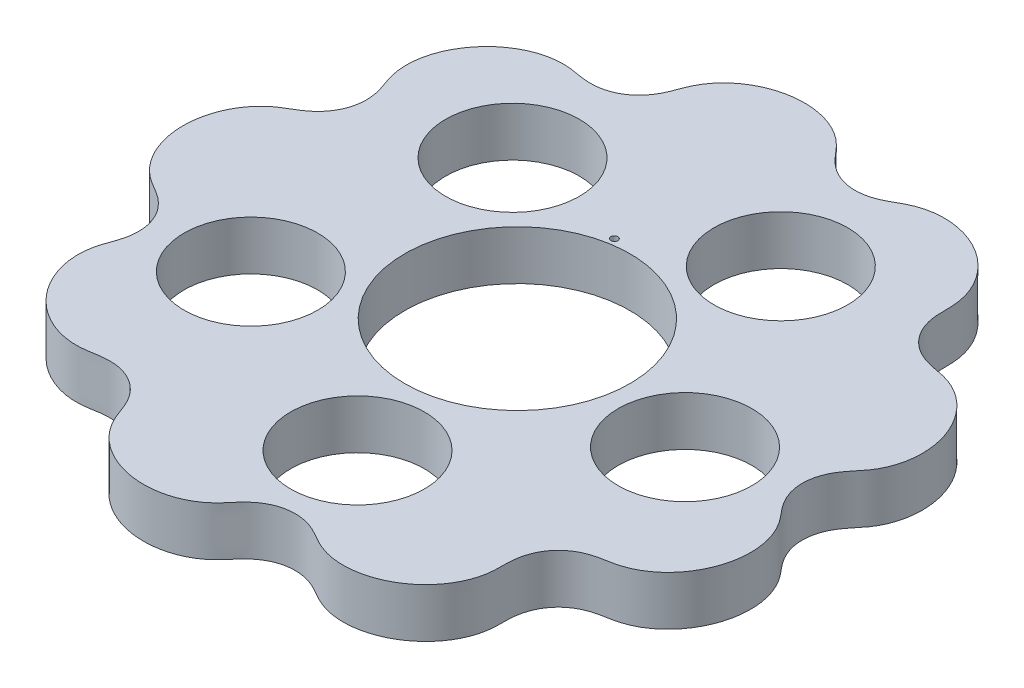
from build123d import *

# Parameters (mm, degrees)
BOSS_EXTRUDE3_DEPTH = 7
SKETCH2_R           = 16
CUT_EXTRUDE1_DEPTH  = 68.161043744
SKETCH3_R           = 0.5
CUT_EXTRUDE2_DEPTH  = 1
SKETCH4_R           = 9.5
CUT_EXTRUDE4_DEPTH  = 68.161043744
CIRPATTERN2_COUNT   = 5


with BuildPart() as part:
    # Sketch1 → Boss-Extrude3 (new body)
    with BuildSketch(Plane(origin=(0, 0, 0), x_dir=(1, 0, 0), z_dir=(0, 1, 0))):
        with BuildLine():
            add(Edge.make_bspline(
                [(40.5, 0), (40.5, -0.028546262), (40.500444384, -0.085847505), (40.503110675, -0.226757994), (40.512439134, -0.442367355), (40.531079589, -0.666953273), (40.562964523, -0.93744797), (40.605352949, -1.20098898), (40.671319498, -1.530508494), (40.770992467, -1.920340014), (40.916415736, -2.367488249), (41.120787297, -2.86406858), (41.360828638, -3.344593408), (41.654124201, -3.842056085), (42.004011353, -4.351634881), (42.409931661, -4.87004421), (42.859744386, -5.404533646), (43.412858525, -6.080456207), (44.011394999, -6.943224647), (44.526656093, -7.941817117), (44.929873097, -9.064739057), (45.239557641, -10.363340474), (45.403552015, -11.834318039), (45.343955448, -13.562903017), (44.952767157, -15.484258179), (44.263691832, -17.30324519), (43.301446593, -18.976060486), (42.091119135, -20.460306087), (40.745114847, -21.632645784), (39.4837748, -22.404905161), (38.409421356, -22.87085064), (37.58482604, -23.133693034), (36.911896387, -23.296665171), (36.231624071, -23.422347011), (35.550357106, -23.543060285), (34.525833701, -23.764578493), (33.191664696, -24.223802594), (31.668403783, -25.17653147), (30.277453911, -26.838539011), (29.606690168, -28.516326966), (29.392777642, -29.929876757), (29.357806824, -30.990097872), (29.358413065, -31.688831297), (29.349816232, -32.38747332), (29.299961965, -33.084991258), (29.174540456, -33.950025236), (28.884387048, -35.107402938), (28.311499455, -36.509844746), (27.339845304, -38.066173972), (26.017933712, -39.535863134), (24.483232188, -40.756368749), (22.786217155, -41.706943572), (20.973888334, -42.369957392), (19.092781226, -42.729068837), (17.308191097, -42.762066376), (15.845599211, -42.543012056), (14.723107044, -42.209492119), (13.922481374, -41.880898383), (13.302227917, -41.573264045), (12.700331173, -41.232317813), (12.100892811, -40.886879519), (11.173757722, -40.397959474), (9.856673355, -39.891987769), (8.077462722, -39.642383823), (5.943546794, -40.021078588), (4.35107352, -40.874919681), (3.278410562, -41.82014524), (2.570026037, -42.609815625), (2.121324054, -43.14548158), (1.665672599, -43.675196771), (1.17915445, -44.177550209), (0.527074936, -44.759678615), (-0.439116024, -45.459900339), (-1.779443431, -46.16613343), (-3.524197134, -46.733933196), (-5.481604637, -47.01020213), (-7.441825317, -46.958776742), (-9.352850307, -46.596232476), (-11.167346953, -45.939296019), (-12.839175378, -45.005380711), (-14.227481209, -43.883694812), (-15.207137934, -42.775886443), (-15.8527027, -41.798978164), (-16.254862767, -41.032703987), (-16.532309197, -40.398405281), (-16.774256512, -39.750374585), (-17.011382172, -39.100464804), (-17.407232747, -38.129986286), (-18.090734887, -36.895738292), (-19.292992813, -35.560693356), (-21.170888335, -34.478791677), (-22.939600319, -34.108936434), (-24.368953497, -34.143319399), (-25.419255652, -34.292817002), (-26.107333056, -34.414733809), (-26.796899433, -34.527678603), (-27.492523445, -34.599847189), (-28.366265702, -34.626726892), (-29.556564689, -34.542186472), (-31.037364726, -34.221759337), (-32.739020732, -33.535305745), (-34.416198682, -32.488799683), (-35.884858276, -31.18944768), (-37.115823469, -29.683399253), (-38.083603628, -28.013906623), (-38.764068432, -26.223973991), (-39.106677701, -24.472428153), (-39.145177857, -22.994155066), (-39.011885669, -21.830876801), (-38.827502006, -20.985391696), (-38.632390711, -20.321161986), (-38.401231573, -19.669237126), (-38.16512026, -19.018990926), (-37.844472406, -18.021185774), (-37.574515437, -16.63645071), (-37.637035998, -14.840974018), (-38.379780688, -12.804965911), (-39.496728402, -11.38451469), (-40.613694939, -10.491881423), (-41.514358285, -9.93118044), (-42.119843128, -9.582259903), (-42.720728116, -9.225557564), (-43.300060014, -8.833742323), (-43.986749018, -8.292751926), (-44.844349958, -7.462927163), (-45.772882603, -6.265657891), (-46.635339888, -4.645985087), (-47.247585718, -2.766214576), (-47.53755206, -0.826771723), (-47.512538074, 1.118150057), (-47.180899933, 3.019157212), (-46.551717848, 4.82759835), (-45.688513543, 6.389712558), (-44.659677617, 7.682658763), (-43.660583675, 8.585180175), (-42.80632761, 9.177558511), (-42.061022055, 9.615676605), (-41.462290621, 9.962188423), (-40.575230987, 10.520252942), (-39.478283352, 11.407345976), (-38.371827395, 12.822697306), (-37.631719247, 14.859682224), (-37.573981258, 16.66577966), (-37.855665099, 18.067658738), (-38.185125935, 19.076182338), (-38.424672753, 19.732705207), (-38.655741816, 20.392209654), (-38.84775704, 21.064754755), (-39.026145406, 21.920593216), (-39.149828944, 23.107566863), (-39.09166123, 24.621654983), (-38.711352212, 26.416866751), (-37.972140765, 28.250537991), (-36.947690329, 29.922687192), (-35.678415605, 31.396609852), (-34.202539584, 32.639673184), (-32.558208903, 33.620763916), (-30.893027292, 34.262453372), (-29.444043299, 34.557364541), (-28.275455034, 34.628220061), (-27.410787202, 34.59381281), (-26.72299369, 34.51674286), (-25.869954657, 34.37468004), (-24.669041681, 34.158214449), (-23.08279894, 34.077875033), (-21.153335322, 34.487400981), (-19.276935597, 35.57150577), (-18.071444448, 36.917919199), (-17.385945872, 38.172738501), (-16.989933536, 39.157152765), (-16.751426332, 39.814042019), (-16.504532297, 40.467847806), (-16.219376456, 41.106515426), (-15.805967264, 41.876873687), (-15.137812701, 42.865756434), (-14.120067415, 43.988363872), (-12.674813604, 45.119268791), (-10.929865296, 46.048932451), (-9.07024603, 46.671478061), (-7.150520531, 46.984788652), (-5.22094989, 46.988455169), (-3.330749558, 46.683186857), (-1.642708761, 46.104538007), (-0.343153942, 45.399206832), (0.597608896, 44.702454803), (1.237898732, 44.120391681), (1.715264854, 43.619314217), (2.277428439, 42.962224797), (3.05814935, 42.024466828), (4.221431586, 40.943188501), (5.962527814, 40.016387543), (8.096711616, 39.640341864), (9.8857068, 39.896574295), (11.217544346, 40.417019048), (12.153760139, 40.916512679), (12.758740403, 41.266413668), (13.368136186, 41.608608887), (13.997103, 41.914636892), (14.808971415, 42.239129975), (15.956466314, 42.567304505), (17.457750275, 42.77321507), (19.291893972, 42.710676226), (21.226285158, 42.301308336), (23.051077454, 41.582944449), (24.72311385, 40.58906004), (26.203639767, 39.351667841), (27.455428384, 37.902959871), (28.376663871, 36.374770576), (28.918896787, 34.999224905), (29.191799656, 33.860848331), (29.308231189, 33.003441465), (29.35189076, 32.312783633), (29.360213444, 31.448109042), (29.355429648, 30.227962288), (29.55128759, 28.651955964), (30.288977261, 26.822741751), (31.681833263, 25.162592811), (33.216849137, 24.208650605), (34.571622102, 23.751028062), (35.609898879, 23.531775073), (36.298280537, 23.410922873), (36.985100939, 23.281383187), (37.663674553, 23.111581309), (38.494246664, 22.838372965), (39.584321034, 22.352260536), (40.866852273, 21.545065261), (42.231836487, 20.318237829), (43.450673844, 18.761249102), (44.386902236, 17.038007017), (45.028986087, 15.201914615), (45.325834952, 13.537932906), (45.38524027, 12.105954443), (45.301179192, 10.916329332), (45.151752518, 9.973924387), (44.891593523, 8.9443326), (44.543978069, 8.009424638), (44.128014858, 7.175589871), (43.712312671, 6.517140841), (43.409686217, 6.095664039), (43.090923809, 5.686434175), (42.815647705, 5.353194457), (42.538178372, 5.021818387), (42.266840334, 4.685368008), (42.055952198, 4.411281643), (41.826782884, 4.093710697), (41.585989593, 3.728402516), (41.342712158, 3.310613657), (41.108278103, 2.835929575), (40.908702201, 2.34568584), (40.766567017, 1.904604137), (40.669049377, 1.520127878), (40.604388983, 1.195338878), (40.562761071, 0.935408444), (40.531326441, 0.668993371), (40.512839165, 0.447641437), (40.503412283, 0.23442177), (40.500585942, 0.096138553), (40.50005783, 0.039653659), (40.500009824, 0.011516445)],
                knots=[0.074406451, 0.074406451, 0.074406451, 0.074406451, 0.074406451, 0.074767472, 0.075128494, 0.075850538, 0.076572582, 0.077294626, 0.07801667, 0.078738713, 0.080182801, 0.081626889, 0.083070976, 0.084515064, 0.085959151, 0.087839211, 0.089719271, 0.09159933, 0.09347939, 0.097239509, 0.100999628, 0.103646586, 0.106293543, 0.111587458, 0.116881374, 0.122175289, 0.127305755, 0.132436222, 0.137566688, 0.142697155, 0.146420505, 0.148282179, 0.150143854, 0.152005529, 0.153867204, 0.155728878, 0.157590553, 0.163285985, 0.168981417, 0.174757993, 0.180534569, 0.18241471, 0.184294852, 0.186174994, 0.188055135, 0.189935277, 0.191815418, 0.195575702, 0.200869839, 0.206163976, 0.211458113, 0.21675225, 0.221882498, 0.227012746, 0.232142994, 0.237273242, 0.240996426, 0.242858018, 0.24471961, 0.246581203, 0.248442795, 0.250304387, 0.252165979, 0.257861181, 0.263556383, 0.269333184, 0.275109986, 0.276990209, 0.278870433, 0.280750657, 0.28263088, 0.284511104, 0.286391328, 0.290151775, 0.295446135, 0.300740494, 0.306034853, 0.311329212, 0.316459241, 0.32158927, 0.326719299, 0.331849328, 0.335572348, 0.337433857, 0.339295367, 0.341156877, 0.343018386, 0.344879896, 0.346741406, 0.352436377, 0.358131349, 0.363908375, 0.369685402, 0.371565708, 0.373446014, 0.37532632, 0.377206626, 0.379086932, 0.380967237, 0.384727849, 0.39002243, 0.395317011, 0.400611593, 0.405906174, 0.411035984, 0.416165794, 0.421295605, 0.426425415, 0.430148269, 0.432009697, 0.433871124, 0.435732551, 0.437593978, 0.439455405, 0.441316832, 0.447011574, 0.452706315, 0.458483567, 0.464260818, 0.466141206, 0.468021595, 0.469901983, 0.471782371, 0.473662759, 0.475543147, 0.479303923, 0.484598726, 0.489893529, 0.495188332, 0.500483135, 0.505612727, 0.510742319, 0.51587191, 0.521001502, 0.524724191, 0.52844688, 0.530308225, 0.53216957, 0.534030915, 0.535892259, 0.54158677, 0.547281281, 0.553058758, 0.558836234, 0.560716705, 0.562597175, 0.564477645, 0.566358116, 0.568238586, 0.570119056, 0.573879997, 0.579175022, 0.584470047, 0.589765072, 0.595060097, 0.60018947, 0.605318843, 0.610448215, 0.615577588, 0.619300113, 0.621161375, 0.623022637, 0.6248839, 0.626745162, 0.630467687, 0.636161967, 0.641856247, 0.647633949, 0.65341165, 0.655292203, 0.657172755, 0.659053308, 0.66093386, 0.662814413, 0.664694966, 0.668456071, 0.673751318, 0.679046565, 0.684341812, 0.689637059, 0.694766213, 0.699895367, 0.705024521, 0.710153675, 0.713876034, 0.715737214, 0.717598394, 0.719459574, 0.721320754, 0.725043114, 0.730737164, 0.736431213, 0.742209139, 0.747987065, 0.7498677, 0.751748335, 0.75362897, 0.755509605, 0.75739024, 0.759270875, 0.763032145, 0.768327614, 0.773623083, 0.778918551, 0.78421402, 0.789342955, 0.794471891, 0.799600826, 0.804729761, 0.808451956, 0.810313054, 0.812174151, 0.814035249, 0.815896347, 0.819618542, 0.825312361, 0.831006179, 0.83678433, 0.84256248, 0.844443198, 0.846323915, 0.848204632, 0.85008535, 0.851966067, 0.853846784, 0.857608219, 0.86290391, 0.8681996, 0.873495291, 0.878790982, 0.883919698, 0.889048415, 0.891612773, 0.894177131, 0.896741489, 0.899305847, 0.903027878, 0.904888893, 0.906749909, 0.907680416, 0.908610924, 0.910471939, 0.911402447, 0.912332955, 0.913263462, 0.91419397, 0.915617367, 0.917040764, 0.918464161, 0.919887558, 0.921310955, 0.922022653, 0.922734351, 0.92344605, 0.924157748, 0.924869447, 0.925225296, 0.925581145, 0.925581145, 0.925581145, 0.925581145, 0.925581145], degree=4))
            Line((40.500009824, 0.011516445), (40.5, 0))
        make_face()
    extrude(amount=BOSS_EXTRUDE3_DEPTH)

    # Sketch2 → Cut-Extrude1 (cut, through all)
    with BuildSketch(Plane(origin=(0, 7, 0), x_dir=(1, 0, 0), z_dir=(0, 1, 0))):
        Circle(SKETCH2_R)
    extrude(amount=-CUT_EXTRUDE1_DEPTH, mode=Mode.SUBTRACT)

    # Sketch3 → Cut-Extrude2 (cut)
    with BuildSketch(Plane(origin=(0, 7, 0), x_dir=(1, 0, 0), z_dir=(0, 1, 0))):
        with Locations((-2.952028405, 16.741730146)):
            Circle(SKETCH3_R)
    extrude(amount=-CUT_EXTRUDE2_DEPTH, mode=Mode.SUBTRACT)

    # Sketch4 → Cut-Extrude4 (cut, through all)
    with BuildSketch(Plane(origin=(0, 7, 0), x_dir=(1, 0, 0), z_dir=(0, 1, 0))):
        with Locations((4.862164432, -27.574614359)):
            Circle(SKETCH4_R)
    cut_extrude4 = extrude(amount=-CUT_EXTRUDE4_DEPTH, mode=Mode.SUBTRACT)

    # CirPattern2: Cut-Extrude4 ×5 about axis
    cirpattern2_axis = Axis((0, 0, 0), (0, 1, 0))
    for i in range(1, CIRPATTERN2_COUNT):
        add(cut_extrude4.rotate(cirpattern2_axis, i * 360 / CIRPATTERN2_COUNT), mode=Mode.SUBTRACT)


solid = part.part
